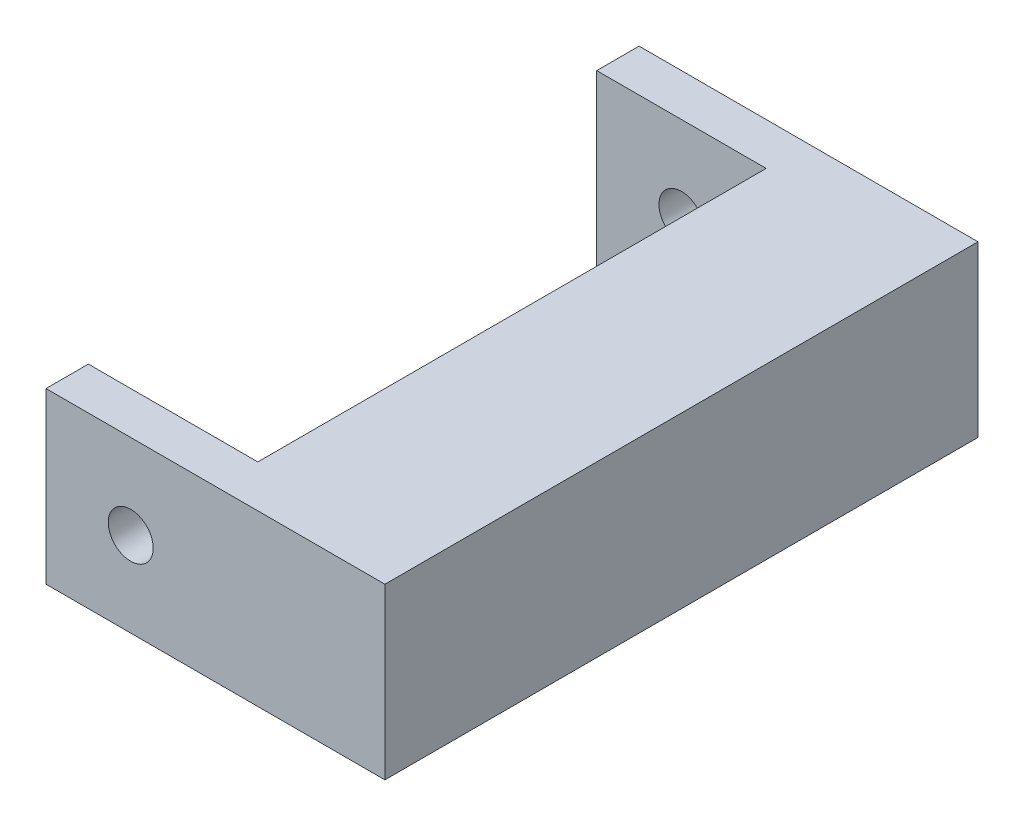
from build123d import *

# Parameters (mm, degrees)
SKETCH2_W           = 20
SKETCH2_H           = 20
SKETCH2_R           = 2.655
BOSS_EXTRUDE1_DEPTH = 5
SKETCH2_3_W         = 20
SKETCH2_3_H         = 20
BOSS_EXTRUDE2_DEPTH = 70
BOSS_EXTRUDE3_START = 65
SKETCH2_4_W         = 20
SKETCH2_4_H         = 20
SKETCH2_4_R         = 2.655
BOSS_EXTRUDE3_DEPTH = 5


with BuildPart() as part:
    # Sketch2 → Boss-Extrude1 (new body)
    with BuildSketch(Plane.XY):
        Rectangle(SKETCH2_W, SKETCH2_H)
        Circle(SKETCH2_R, mode=Mode.SUBTRACT)
    extrude(amount=BOSS_EXTRUDE1_DEPTH)

    # Sketch2<3> → Boss-Extrude2 (add)
    with BuildSketch(Plane.XY):
        with Locations((20, 0)):
            Rectangle(SKETCH2_3_W, SKETCH2_3_H)
    extrude(amount=BOSS_EXTRUDE2_DEPTH)

    # Sketch2<4> → Boss-Extrude3 (add)
    with BuildSketch(Plane.XY.offset(BOSS_EXTRUDE3_START)):
        Rectangle(SKETCH2_4_W, SKETCH2_4_H)
        Circle(SKETCH2_4_R, mode=Mode.SUBTRACT)
    extrude(amount=BOSS_EXTRUDE3_DEPTH)


solid = part.part
